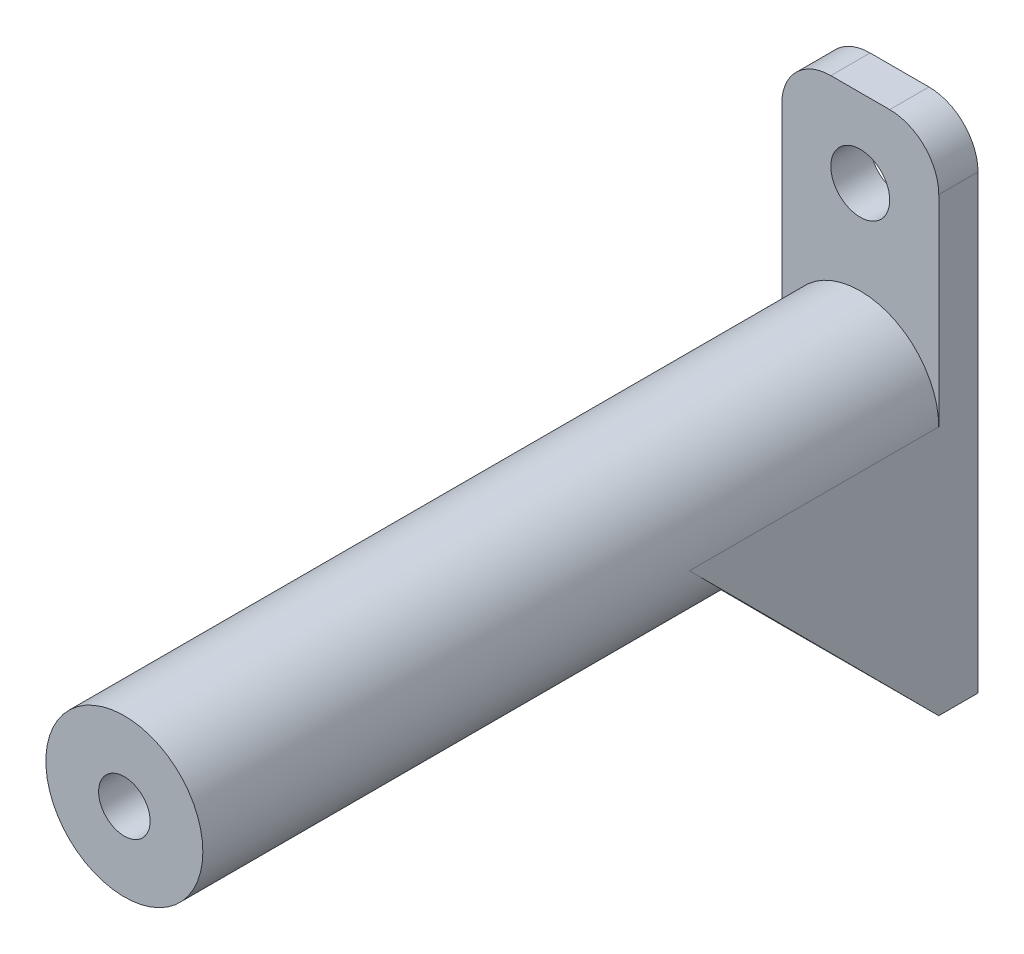
from build123d import *

# Parameters (mm, degrees)
SKETCH1_W           = 16
SKETCH1_H           = 51
SKETCH1_R           = 3
BOSS_EXTRUDE1_DEPTH = 4
SKETCH2_R           = 8
BOSS_EXTRUDE2_DEPTH = 75
BOSS_EXTRUDE3_DEPTH = 2
SKETCH5_R           = 2.625
CUT_EXTRUDE1_DEPTH  = 35
FILLET1_R           = 5


with BuildPart() as part:
    # Sketch1 → Boss-Extrude1 (new body)
    with BuildSketch(Plane.XY):
        Rectangle(SKETCH1_W, SKETCH1_H)
        with Locations((0, 17.5)):
            Circle(SKETCH1_R, mode=Mode.SUBTRACT)
        with Locations((0, -17.5)):
            Circle(SKETCH1_R, mode=Mode.SUBTRACT)
    extrude(amount=BOSS_EXTRUDE1_DEPTH)

    # Sketch2 → Boss-Extrude2 (add)
    with BuildSketch(Plane.XY.offset(4)):
        Circle(SKETCH2_R)
    extrude(amount=BOSS_EXTRUDE2_DEPTH)

    # Sketch4 → Boss-Extrude3 (add)
    with BuildSketch(Plane(origin=(8, 0, 0), x_dir=(0, 0, -1), z_dir=(1, 0, 0))):
        Polygon((-4, 0), (-29.4, 0), (-4, -25.5), align=None)
    boss_extrude3 = extrude(amount=-BOSS_EXTRUDE3_DEPTH)

    # Mirror1: Boss-Extrude3 across plane
    add(boss_extrude3.mirror(Plane(origin=(0, 0, 0), x_dir=(0, 0, 1), z_dir=(1, 0, 0))))

    # Sketch5 → Cut-Extrude1 (cut)
    with BuildSketch(Plane.XY.offset(79)):
        Circle(SKETCH5_R)
    extrude(amount=-CUT_EXTRUDE1_DEPTH, mode=Mode.SUBTRACT)

    # Fillet1
    fillet1_edges = [part.edges().sort_by_distance(p)[0] for p in [
        (-8, 25.5, 2),
        (8, 25.5, 2),
    ]]
    fillet(fillet1_edges, radius=FILLET1_R)


solid = part.part
